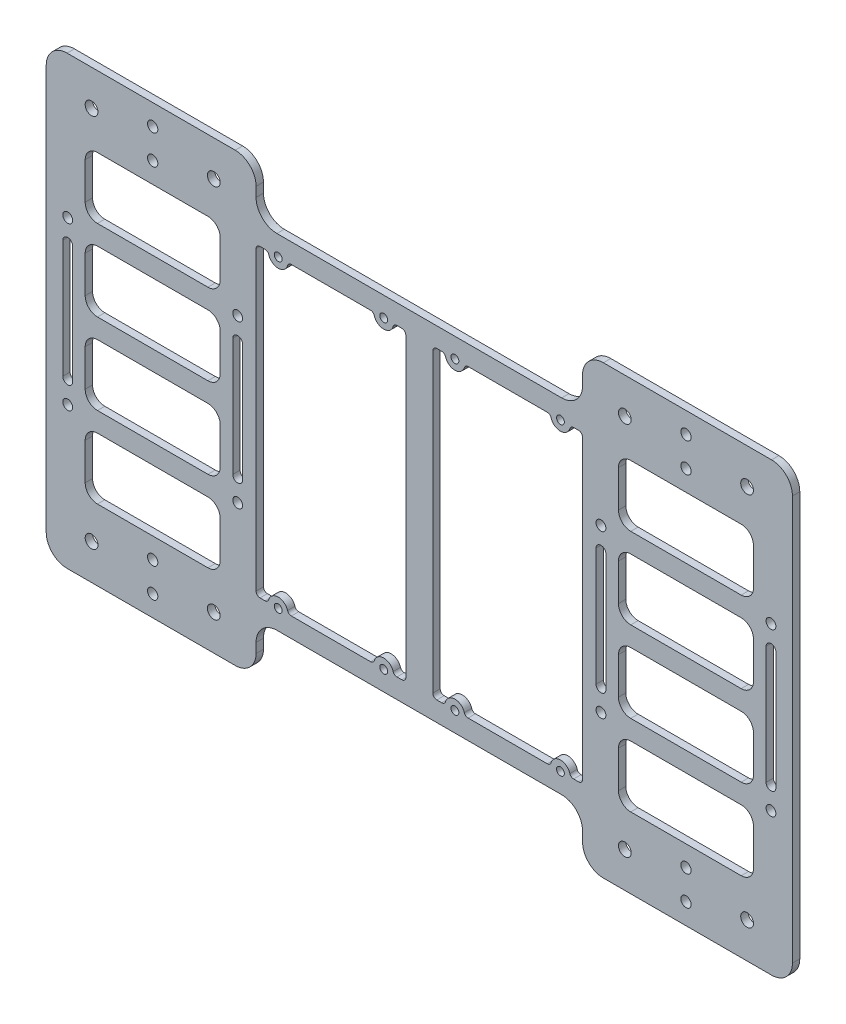
from build123d import *

# Parameters (mm, degrees)
MODEL_R             = 1.6
MODEL_R_2           = 2
MODEL_R_3           = 2.1
MODEL_R_4           = 2.6
BOSS_EXTRUDE1_DEPTH = 3


with BuildPart() as part:
    # Model → Boss-Extrude1 (new body)
    with BuildSketch(Plane.XY):
        with BuildLine():
            Line((-152, -82.407237202), (-152, 82.407237202))
            ThreePointArc((-152, 82.407237202), (-149.51040764, 88.417644842), (-143.5, 90.907237202))
            Line((-143.5, 90.907237202), (-75, 90.907237202))
            ThreePointArc((-75, 90.907237202), (-68.98959236, 88.417644842), (-66.5, 82.407237202))
            Line((-66.5, 82.407237202), (-66.5, 78.5))
            ThreePointArc((-66.5, 78.5), (-64.01040764, 72.48959236), (-58, 70))
            Line((-58, 70), (58, 70))
            ThreePointArc((58, 70), (64.01040764, 72.48959236), (66.5, 78.5))
            Line((66.5, 78.5), (66.5, 82.407237202))
            ThreePointArc((66.5, 82.407237202), (68.98959236, 88.417644842), (75, 90.907237202))
            Line((75, 90.907237202), (143.5, 90.907237202))
            ThreePointArc((143.5, 90.907237202), (149.51040764, 88.417644842), (152, 82.407237202))
            Line((152, 82.407237202), (152, -82.407237202))
            ThreePointArc((152, -82.407237202), (149.51040764, -88.417644842), (143.5, -90.907237202))
            Line((143.5, -90.907237202), (75, -90.907237202))
            ThreePointArc((75, -90.907237202), (68.98959236, -88.417644842), (66.5, -82.407237202))
            Line((66.5, -82.407237202), (66.5, -78.5))
            ThreePointArc((66.5, -78.5), (64.01040764, -72.48959236), (58, -70))
            Line((58, -70), (-58, -70))
            ThreePointArc((-58, -70), (-64.01040764, -72.48959236), (-66.5, -78.5))
            Line((-66.5, -78.5), (-66.5, -82.407237202))
            ThreePointArc((-66.5, -82.407237202), (-68.98959236, -88.417644842), (-75, -90.907237202))
            Line((-75, -90.907237202), (-143.5, -90.907237202))
            ThreePointArc((-143.5, -90.907237202), (-149.51040764, -88.417644842), (-152, -82.407237202))
        make_face()
        with Locations((-57.5, 62)):
            Circle(MODEL_R, mode=Mode.SUBTRACT)
        with Locations((-14.5, 62)):
            Circle(MODEL_R, mode=Mode.SUBTRACT)
        with Locations((-57.5, -62)):
            Circle(MODEL_R, mode=Mode.SUBTRACT)
        with Locations((-14.5, -62)):
            Circle(MODEL_R, mode=Mode.SUBTRACT)
        with Locations((14.5, 62)):
            Circle(MODEL_R, mode=Mode.SUBTRACT)
        with Locations((57.5, 62)):
            Circle(MODEL_R, mode=Mode.SUBTRACT)
        with Locations((14.5, -62)):
            Circle(MODEL_R, mode=Mode.SUBTRACT)
        with Locations((57.5, -62)):
            Circle(MODEL_R, mode=Mode.SUBTRACT)
        with Locations((-143.25, 33)):
            Circle(MODEL_R_2, mode=Mode.SUBTRACT)
        with Locations((-143.25, -33)):
            Circle(MODEL_R_2, mode=Mode.SUBTRACT)
        with Locations((-74, 33)):
            Circle(MODEL_R_2, mode=Mode.SUBTRACT)
        with Locations((-74, -33)):
            Circle(MODEL_R_2, mode=Mode.SUBTRACT)
        with Locations((143.25, 33)):
            Circle(MODEL_R_2, mode=Mode.SUBTRACT)
        with Locations((143.25, -33)):
            Circle(MODEL_R_2, mode=Mode.SUBTRACT)
        with Locations((74, 33)):
            Circle(MODEL_R_2, mode=Mode.SUBTRACT)
        with Locations((74, -33)):
            Circle(MODEL_R_2, mode=Mode.SUBTRACT)
        with Locations((-108.625, -70.407237202)):
            Circle(MODEL_R_3, mode=Mode.SUBTRACT)
        with Locations((-83.725, -76.407237202)):
            Circle(MODEL_R_4, mode=Mode.SUBTRACT)
        with Locations((-108.625, -82.407237202)):
            Circle(MODEL_R_3, mode=Mode.SUBTRACT)
        with Locations((108.625, -70.407237202)):
            Circle(MODEL_R_3, mode=Mode.SUBTRACT)
        with Locations((108.625, -82.407237202)):
            Circle(MODEL_R_3, mode=Mode.SUBTRACT)
        with Locations((-108.625, 70.407237202)):
            Circle(MODEL_R_3, mode=Mode.SUBTRACT)
        with Locations((-108.625, 82.407237202)):
            Circle(MODEL_R_3, mode=Mode.SUBTRACT)
        with Locations((108.625, 70.407237202)):
            Circle(MODEL_R_3, mode=Mode.SUBTRACT)
        with Locations((108.625, 82.407237202)):
            Circle(MODEL_R_3, mode=Mode.SUBTRACT)
        with Locations((-133.525, -76.407237202)):
            Circle(MODEL_R_4, mode=Mode.SUBTRACT)
        with Locations((-83.725, 76.407237202)):
            Circle(MODEL_R_4, mode=Mode.SUBTRACT)
        with Locations((-133.525, 76.407237202)):
            Circle(MODEL_R_4, mode=Mode.SUBTRACT)
        with Locations((83.725, -76.407237202)):
            Circle(MODEL_R_4, mode=Mode.SUBTRACT)
        with Locations((133.525, -76.407237202)):
            Circle(MODEL_R_4, mode=Mode.SUBTRACT)
        with Locations((83.725, 76.407237202)):
            Circle(MODEL_R_4, mode=Mode.SUBTRACT)
        with Locations((133.525, 76.407237202)):
            Circle(MODEL_R_4, mode=Mode.SUBTRACT)
        with BuildLine():
            Line((-62.866563146, 62), (-64.9, 62))
            ThreePointArc((-64.9, 62), (-66.03137085, 61.53137085), (-66.5, 60.4))
            Line((-66.5, 60.4), (-66.5, -60.4))
            ThreePointArc((-66.5, -60.4), (-66.03137085, -61.53137085), (-64.9, -62))
            Line((-64.9, -62), (-62.866563146, -62))
            ThreePointArc((-62.866563146, -62), (-61.910380259, -61.682853961), (-61.33325939, -60.857142857))
            ThreePointArc((-61.33325939, -60.857142857), (-57.5, -58), (-53.66674061, -60.857142857))
            ThreePointArc((-53.66674061, -60.857142857), (-53.089619741, -61.682853961), (-52.133436854, -62))
            Line((-52.133436854, -62), (-19.866563146, -62))
            ThreePointArc((-19.866563146, -62), (-18.910380259, -61.682853961), (-18.33325939, -60.857142857))
            ThreePointArc((-18.33325939, -60.857142857), (-14.5, -58), (-10.66674061, -60.857142857))
            ThreePointArc((-10.66674061, -60.857142857), (-10.089619741, -61.682853961), (-9.133436854, -62))
            Line((-9.133436854, -62), (-7.1, -62))
            ThreePointArc((-7.1, -62), (-5.96862915, -61.53137085), (-5.5, -60.4))
            Line((-5.5, -60.4), (-5.5, 60.4))
            ThreePointArc((-5.5, 60.4), (-5.96862915, 61.53137085), (-7.1, 62))
            Line((-7.1, 62), (-9.133436854, 62))
            ThreePointArc((-9.133436854, 62), (-10.089619741, 61.682853961), (-10.66674061, 60.857142857))
            ThreePointArc((-10.66674061, 60.857142857), (-14.5, 58), (-18.33325939, 60.857142857))
            ThreePointArc((-18.33325939, 60.857142857), (-18.910380259, 61.682853961), (-19.866563146, 62))
            Line((-19.866563146, 62), (-52.133436854, 62))
            ThreePointArc((-52.133436854, 62), (-53.089619741, 61.682853961), (-53.66674061, 60.857142857))
            ThreePointArc((-53.66674061, 60.857142857), (-57.5, 58), (-61.33325939, 60.857142857))
            ThreePointArc((-61.33325939, 60.857142857), (-61.910380259, 61.682853961), (-62.866563146, 62))
        make_face(mode=Mode.SUBTRACT)
        with BuildLine():
            Line((9.133436854, 62), (7.1, 62))
            ThreePointArc((7.1, 62), (5.96862915, 61.53137085), (5.5, 60.4))
            Line((5.5, 60.4), (5.5, -60.4))
            ThreePointArc((5.5, -60.4), (5.96862915, -61.53137085), (7.1, -62))
            Line((7.1, -62), (9.133436854, -62))
            ThreePointArc((9.133436854, -62), (10.089619741, -61.682853961), (10.66674061, -60.857142857))
            ThreePointArc((10.66674061, -60.857142857), (14.5, -58), (18.33325939, -60.857142857))
            ThreePointArc((18.33325939, -60.857142857), (18.910380259, -61.682853961), (19.866563146, -62))
            Line((19.866563146, -62), (52.133436854, -62))
            ThreePointArc((52.133436854, -62), (53.089619741, -61.682853961), (53.66674061, -60.857142857))
            ThreePointArc((53.66674061, -60.857142857), (57.5, -58), (61.33325939, -60.857142857))
            ThreePointArc((61.33325939, -60.857142857), (61.910380259, -61.682853961), (62.866563146, -62))
            Line((62.866563146, -62), (64.9, -62))
            ThreePointArc((64.9, -62), (66.03137085, -61.53137085), (66.5, -60.4))
            Line((66.5, -60.4), (66.5, 60.4))
            ThreePointArc((66.5, 60.4), (66.03137085, 61.53137085), (64.9, 62))
            Line((64.9, 62), (62.866563146, 62))
            ThreePointArc((62.866563146, 62), (61.910380259, 61.682853961), (61.33325939, 60.857142857))
            ThreePointArc((61.33325939, 60.857142857), (57.5, 58), (53.66674061, 60.857142857))
            ThreePointArc((53.66674061, 60.857142857), (53.089619741, 61.682853961), (52.133436854, 62))
            Line((52.133436854, 62), (19.866563146, 62))
            ThreePointArc((19.866563146, 62), (18.910380259, 61.682853961), (18.33325939, 60.857142857))
            ThreePointArc((18.33325939, 60.857142857), (14.5, 58), (10.66674061, 60.857142857))
            ThreePointArc((10.66674061, 60.857142857), (10.089619741, 61.682853961), (9.133436854, 62))
        make_face(mode=Mode.SUBTRACT)
        with BuildLine():
            Line((-81.125, 24), (-81.125, 9))
            ThreePointArc((-81.125, 9), (-82.589466094, 5.464466094), (-86.125, 4))
            Line((-86.125, 4), (-131.125, 4))
            ThreePointArc((-131.125, 4), (-134.660533906, 5.464466094), (-136.125, 9))
            Line((-136.125, 9), (-136.125, 24))
            ThreePointArc((-136.125, 24), (-134.660533906, 27.535533906), (-131.125, 29))
            Line((-131.125, 29), (-86.125, 29))
            ThreePointArc((-86.125, 29), (-82.589466094, 27.535533906), (-81.125, 24))
        make_face(mode=Mode.SUBTRACT)
        with BuildLine():
            Line((-81.125, 57), (-81.125, 42))
            ThreePointArc((-81.125, 42), (-82.589466094, 38.464466094), (-86.125, 37))
            Line((-86.125, 37), (-131.125, 37))
            ThreePointArc((-131.125, 37), (-134.660533906, 38.464466094), (-136.125, 42))
            Line((-136.125, 42), (-136.125, 57))
            ThreePointArc((-136.125, 57), (-134.660533906, 60.535533906), (-131.125, 62))
            Line((-131.125, 62), (-86.125, 62))
            ThreePointArc((-86.125, 62), (-82.589466094, 60.535533906), (-81.125, 57))
        make_face(mode=Mode.SUBTRACT)
        with BuildLine():
            Line((-81.125, -24), (-81.125, -9))
            ThreePointArc((-81.125, -9), (-82.589466094, -5.464466094), (-86.125, -4))
            Line((-86.125, -4), (-131.125, -4))
            ThreePointArc((-131.125, -4), (-134.660533906, -5.464466094), (-136.125, -9))
            Line((-136.125, -9), (-136.125, -24))
            ThreePointArc((-136.125, -24), (-134.660533906, -27.535533906), (-131.125, -29))
            Line((-131.125, -29), (-86.125, -29))
            ThreePointArc((-86.125, -29), (-82.589466094, -27.535533906), (-81.125, -24))
        make_face(mode=Mode.SUBTRACT)
        with BuildLine():
            Line((-81.125, -57), (-81.125, -42))
            ThreePointArc((-81.125, -42), (-82.589466094, -38.464466094), (-86.125, -37))
            Line((-86.125, -37), (-131.125, -37))
            ThreePointArc((-131.125, -37), (-134.660533906, -38.464466094), (-136.125, -42))
            Line((-136.125, -42), (-136.125, -57))
            ThreePointArc((-136.125, -57), (-134.660533906, -60.535533906), (-131.125, -62))
            Line((-131.125, -62), (-86.125, -62))
            ThreePointArc((-86.125, -62), (-82.589466094, -60.535533906), (-81.125, -57))
        make_face(mode=Mode.SUBTRACT)
        with BuildLine():
            Line((81.125, 24), (81.125, 9))
            ThreePointArc((81.125, 9), (82.589466094, 5.464466094), (86.125, 4))
            Line((86.125, 4), (131.125, 4))
            ThreePointArc((131.125, 4), (134.660533906, 5.464466094), (136.125, 9))
            Line((136.125, 9), (136.125, 24))
            ThreePointArc((136.125, 24), (134.660533906, 27.535533906), (131.125, 29))
            Line((131.125, 29), (86.125, 29))
            ThreePointArc((86.125, 29), (82.589466094, 27.535533906), (81.125, 24))
        make_face(mode=Mode.SUBTRACT)
        with BuildLine():
            Line((81.125, 57), (81.125, 42))
            ThreePointArc((81.125, 42), (82.589466094, 38.464466094), (86.125, 37))
            Line((86.125, 37), (131.125, 37))
            ThreePointArc((131.125, 37), (134.660533906, 38.464466094), (136.125, 42))
            Line((136.125, 42), (136.125, 57))
            ThreePointArc((136.125, 57), (134.660533906, 60.535533906), (131.125, 62))
            Line((131.125, 62), (86.125, 62))
            ThreePointArc((86.125, 62), (82.589466094, 60.535533906), (81.125, 57))
        make_face(mode=Mode.SUBTRACT)
        with BuildLine():
            Line((81.125, -24), (81.125, -9))
            ThreePointArc((81.125, -9), (82.589466094, -5.464466094), (86.125, -4))
            Line((86.125, -4), (131.125, -4))
            ThreePointArc((131.125, -4), (134.660533906, -5.464466094), (136.125, -9))
            Line((136.125, -9), (136.125, -24))
            ThreePointArc((136.125, -24), (134.660533906, -27.535533906), (131.125, -29))
            Line((131.125, -29), (86.125, -29))
            ThreePointArc((86.125, -29), (82.589466094, -27.535533906), (81.125, -24))
        make_face(mode=Mode.SUBTRACT)
        with BuildLine():
            Line((81.125, -57), (81.125, -42))
            ThreePointArc((81.125, -42), (82.589466094, -38.464466094), (86.125, -37))
            Line((86.125, -37), (131.125, -37))
            ThreePointArc((131.125, -37), (134.660533906, -38.464466094), (136.125, -42))
            Line((136.125, -42), (136.125, -57))
            ThreePointArc((136.125, -57), (134.660533906, -60.535533906), (131.125, -62))
            Line((131.125, -62), (86.125, -62))
            ThreePointArc((86.125, -62), (82.589466094, -60.535533906), (81.125, -57))
        make_face(mode=Mode.SUBTRACT)
        with BuildLine():
            Line((-145.25, 24), (-145.25, -24))
            ThreePointArc((-145.25, -24), (-143.25, -26), (-141.25, -24))
            Line((-141.25, -24), (-141.25, 24))
            ThreePointArc((-141.25, 24), (-143.25, 26), (-145.25, 24))
        make_face(mode=Mode.SUBTRACT)
        with BuildLine():
            Line((-72, 24), (-72, -24))
            ThreePointArc((-72, -24), (-74, -26), (-76, -24))
            Line((-76, -24), (-76, 24))
            ThreePointArc((-76, 24), (-74, 26), (-72, 24))
        make_face(mode=Mode.SUBTRACT)
        with BuildLine():
            Line((145.25, 24), (145.25, -24))
            ThreePointArc((145.25, -24), (143.25, -26), (141.25, -24))
            Line((141.25, -24), (141.25, 24))
            ThreePointArc((141.25, 24), (143.25, 26), (145.25, 24))
        make_face(mode=Mode.SUBTRACT)
        with BuildLine():
            Line((72, 24), (72, -24))
            ThreePointArc((72, -24), (74, -26), (76, -24))
            Line((76, -24), (76, 24))
            ThreePointArc((76, 24), (74, 26), (72, 24))
        make_face(mode=Mode.SUBTRACT)
    extrude(amount=BOSS_EXTRUDE1_DEPTH)


solid = part.part
